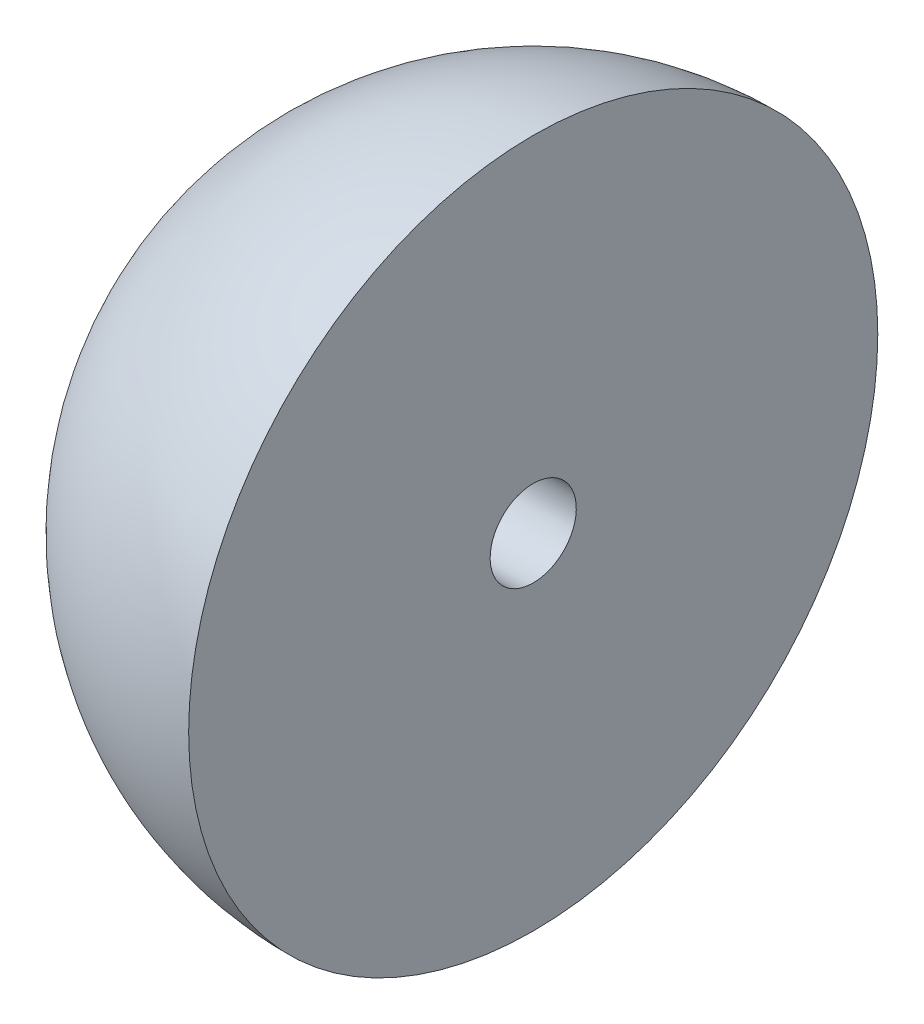
from build123d import *

# Parameters (mm, degrees)
REVOLVE1_ANGLE          = 180
SKETCH2_R               = 2.25
CUT_EXTRUDE1_DEPTH      = 15
CUT_EXTRUDE2_DEPTH      = 5
CUT_EXTRUDE2_DEPTH_BACK = 32.176914536
SKETCH4_W               = 3
SKETCH4_H               = 7


with BuildPart() as part:
    # Sketch1 → Revolve1 (revolve)
    with BuildSketch(Plane(origin=(0, 0, 0), x_dir=(0, 0, -1), z_dir=(1, 0, 0))):
        with BuildLine():
            Line((-18, 0), (18, 0))
            ThreePointArc((18, 0), (0, -18), (-18, 0))
        make_face()
    revolve(axis=Axis((0, 0, 18), (0, 0, -1)), revolution_arc=REVOLVE1_ANGLE)

    # Sketch2 → Cut-Extrude1 (cut)
    with BuildSketch(Plane(origin=(0, 0, 0), x_dir=(0, 0, -1), z_dir=(1, 0, 0))):
        Circle(SKETCH2_R)
    extrude(amount=-CUT_EXTRUDE1_DEPTH, mode=Mode.SUBTRACT)

    # Sketch4 → Cut-Extrude2 (cut, two sides: drawn at the far end of the back side and taken through both)
    with BuildSketch(Plane(origin=(0, 0, 0), x_dir=(1, 0, 0), z_dir=(0, 1, 0)).offset(-CUT_EXTRUDE2_DEPTH_BACK)):
        with Locations((-7.141823204, 0)):
            Rectangle(SKETCH4_W, SKETCH4_H)
    extrude(amount=CUT_EXTRUDE2_DEPTH + CUT_EXTRUDE2_DEPTH_BACK, mode=Mode.SUBTRACT)


solid = part.part
